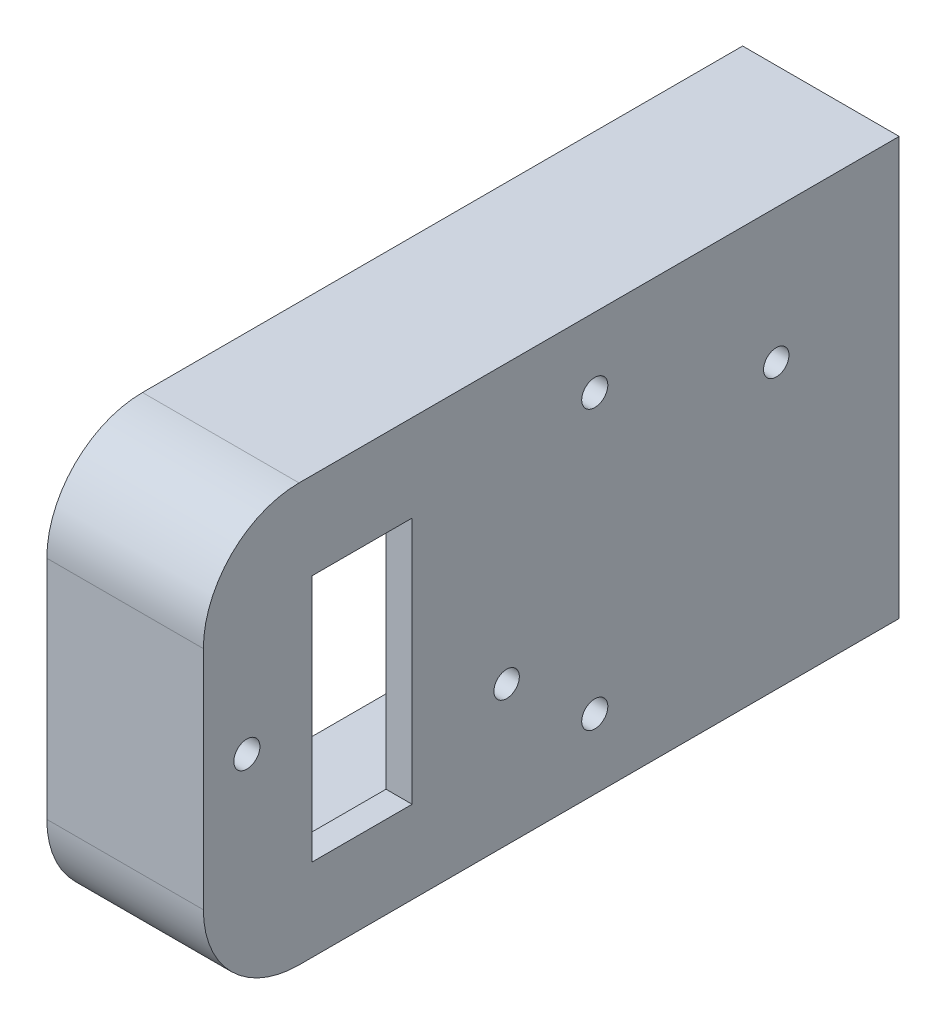
from build123d import *

# Parameters (mm, degrees)
RESSALTO_EXTRUS_O2_DEPTH = 3
RESSALTO_EXTRUS_O3_START = 15
RESSALTO_EXTRUS_O3_DEPTH = 15
ESBO_O3_R                = 1.5
CORTE_EXTRUS_O1_DEPTH    = 51
ESBO_O4_R                = 1.4605
CORTE_EXTRUS_O2_DEPTH    = 50
ESBO_O5_W                = 28.5
ESBO_O5_H                = 11.5
ESBO_O5_W_2              = 27.5
ESBO_O5_H_2              = 10.5
CORTE_EXTRUS_O3_DEPTH    = 50


with BuildPart() as part:
    # Esboço1 → Ressalto-extrusão2 (new body)
    with BuildSketch(Plane.YZ):
        with BuildLine():
            Line((-13, 40), (13, 40))
            ThreePointArc((13, 40), (20.778174593, 36.778174593), (24, 29))
            Line((24, 29), (24, -40))
            Line((24, -40), (-24, -40))
            Line((-24, -40), (-24, 29))
            ThreePointArc((-24, 29), (-20.778174593, 36.778174593), (-13, 40))
        make_face()
    extrude(amount=RESSALTO_EXTRUS_O2_DEPTH)

    # Esboço2 → Ressalto-extrusão3 (add)
    with BuildSketch(Plane(origin=(0, 0, 0), x_dir=(0, -1, 0), z_dir=(-1, 0, 0)).offset(RESSALTO_EXTRUS_O3_START)):
        with BuildLine():
            Line((-13, 40), (13, 40))
            ThreePointArc((13, 40), (20.778174593, 36.778174593), (24, 29))
            Line((24, 29), (24, -40))
            Line((24, -40), (-24, -40))
            Line((-24, -40), (-24, 29))
            ThreePointArc((-24, 29), (-20.778174593, 36.778174593), (-13, 40))
        make_face()
        with BuildLine():
            Line((-20, -37), (20, -37))
            Line((20, -37), (20, 26))
            ThreePointArc((20, 26), (16.778174593, 33.778174593), (9, 37))
            Line((9, 37), (-9, 37))
            ThreePointArc((-9, 37), (-16.778174593, 33.778174593), (-20, 26))
            Line((-20, 26), (-20, -37))
        make_face(mode=Mode.SUBTRACT)
    extrude(amount=-RESSALTO_EXTRUS_O3_DEPTH)

    # Esboço3 → Corte-extrusão1 (cut, through all)
    with BuildSketch(Plane.YZ.offset(3)):
        with Locations(Location((0, 35, 0), (0, 0, 270))):
            Circle(ESBO_O3_R)
        with Locations(Location((16, -5, 0), (0, 0, 270))):
            Circle(ESBO_O3_R)
        with Locations(Location((-16, -5, 0), (0, 0, 270))):
            Circle(ESBO_O3_R)
    extrude(amount=-CORTE_EXTRUS_O1_DEPTH, mode=Mode.SUBTRACT)

    # Esboço4 → Corte-extrusão2 (cut, through all)
    with BuildSketch(Plane(origin=(0, 0, 0), x_dir=(0, -1, 0), z_dir=(-1, 0, 0))):
        with Locations(Location((7.948942217, 5.133929433, 0), (0, 0, 90))):
            Circle(ESBO_O4_R)
        with Locations(Location((-8.5738, -25.8659, 0), (0, 0, 90))):
            Circle(ESBO_O4_R)
    extrude(amount=-CORTE_EXTRUS_O2_DEPTH, mode=Mode.SUBTRACT)

    # Esboço5 → Corte-extrusão3 (cut, through all)
    # profile 1 of 2: a face of its own
    with BuildSketch(Plane(origin=(0, 0, 0), x_dir=(0, -1, 0), z_dir=(-1, 0, 0))):
        with Locations((0.25, 21.75)):
            Rectangle(ESBO_O5_W, ESBO_O5_H)
        with Locations((0.25, 21.75)):
            Rectangle(ESBO_O5_W_2, ESBO_O5_H_2, mode=Mode.SUBTRACT)
    # profile 2 of 2: a face of its own
    with BuildSketch(Plane(origin=(0, 0, 0), x_dir=(0, -1, 0), z_dir=(-1, 0, 0))):
        with Locations((0.25, 21.75)):
            Rectangle(ESBO_O5_W_2, ESBO_O5_H_2)
    extrude(amount=-CORTE_EXTRUS_O3_DEPTH, mode=Mode.SUBTRACT)


solid = part.part
